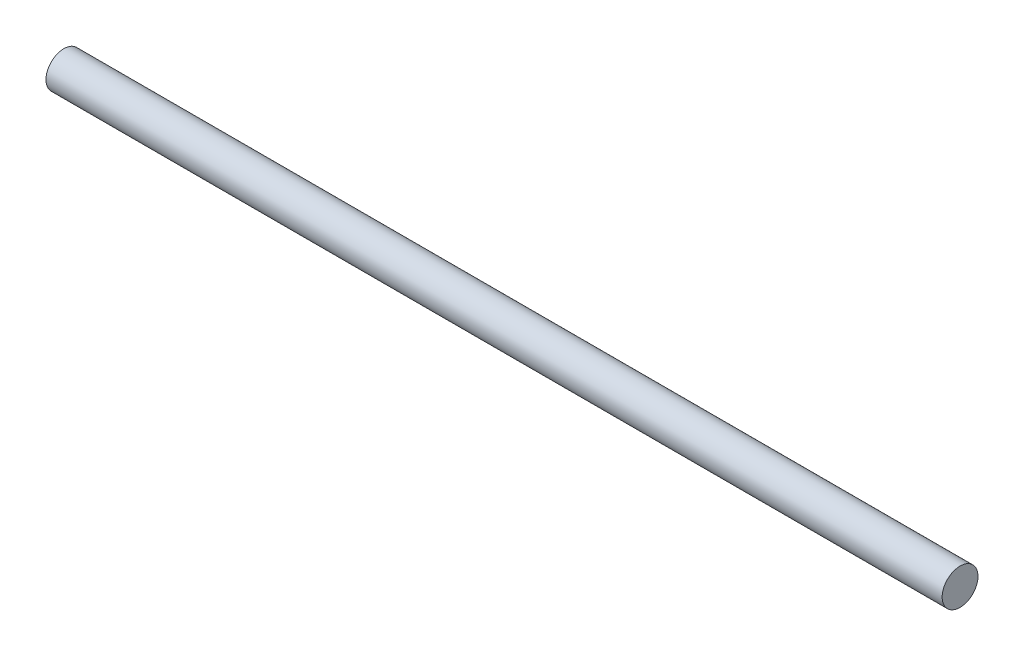
from build123d import *

# Parameters (mm, degrees)
SKETCH1_R           = 3.556
BOSS_EXTRUDE1_DEPTH = 177.8


with BuildPart() as part:
    # Sketch1 → Boss-Extrude1 (new body)
    with BuildSketch(Plane(origin=(0, 0, 0), x_dir=(0, 0, -1), z_dir=(1, 0, 0))):
        Circle(SKETCH1_R)
    extrude(amount=BOSS_EXTRUDE1_DEPTH)


solid = part.part
